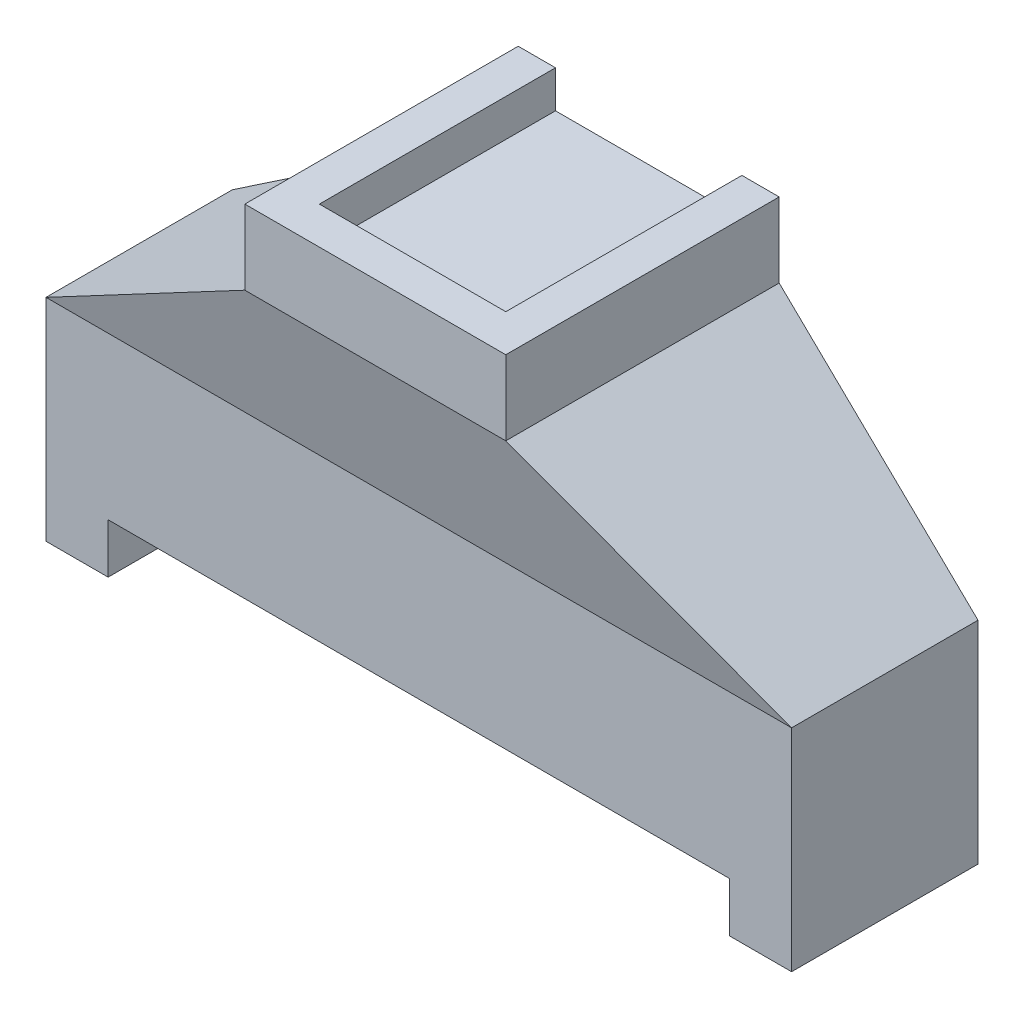
from build123d import *

# Parameters (mm, degrees)
SKETCH1_W           = 60
SKETCH1_H           = 15
BOSS_EXTRUDE1_DEPTH = 13
SKETCH4_W           = 5
SKETCH4_H           = 15
BOSS_EXTRUDE2_DEPTH = 4
SKETCH5_W           = 21
SKETCH5_H           = 22
BOSS_EXTRUDE3_DEPTH = 3
BOSS_EXTRUDE4_DEPTH = 3


with BuildPart() as part:
    # Sketch1 → Boss-Extrude1 (new body)
    with BuildSketch(Plane(origin=(0, 0, 0), x_dir=(1, 0, 0), z_dir=(0, 1, 0))):
        Rectangle(SKETCH1_W, SKETCH1_H)
    extrude(amount=BOSS_EXTRUDE1_DEPTH)

    # Sketch4 → Boss-Extrude2 (add)
    with BuildSketch(Plane(origin=(0, 0, 0), x_dir=(-1, 0, 0), z_dir=(0, -1, 0))):
        with Locations((27.5, 0)):
            Rectangle(SKETCH4_W, SKETCH4_H)
    boss_extrude2 = extrude(amount=BOSS_EXTRUDE2_DEPTH)

    # Mirror1: Boss-Extrude2 across plane
    add(boss_extrude2.mirror(Plane(origin=(0, 0, 0), x_dir=(0, 0, 1), z_dir=(1, 0, 0))))



with BuildPart() as body_2:
    # Sketch5 → Boss-Extrude3 (new body)
    with BuildSketch(Plane(origin=(0, 28, 0), x_dir=(-1, 0, 0), z_dir=(0, -1, 0))):
        Rectangle(SKETCH5_W, SKETCH5_H)
    extrude(amount=BOSS_EXTRUDE3_DEPTH)


with BuildPart() as part_1:
    add(part.part)

    add(body_2.part)  # loft1 joins it to this body
    # loft from a face of the part (loft1)
    loft([part_1.faces().sort_by_distance((0, 13, 0))[0], part_1.faces().sort_by_distance((0, 25, 0))[0]])

    # Sketch7 → Boss-Extrude4 (add)
    with BuildSketch(Plane(origin=(0, 28, 0), x_dir=(-1, 0, 0), z_dir=(0, -1, 0))):
        Polygon((10.5, 11), (7.5, 11), (7.5, -8), (-7.5, -8), (-7.5, 11), (-10.5, 11), (-10.5, -11), (10.5, -11), align=None)
    extrude(amount=-BOSS_EXTRUDE4_DEPTH)


solid = part_1.part
